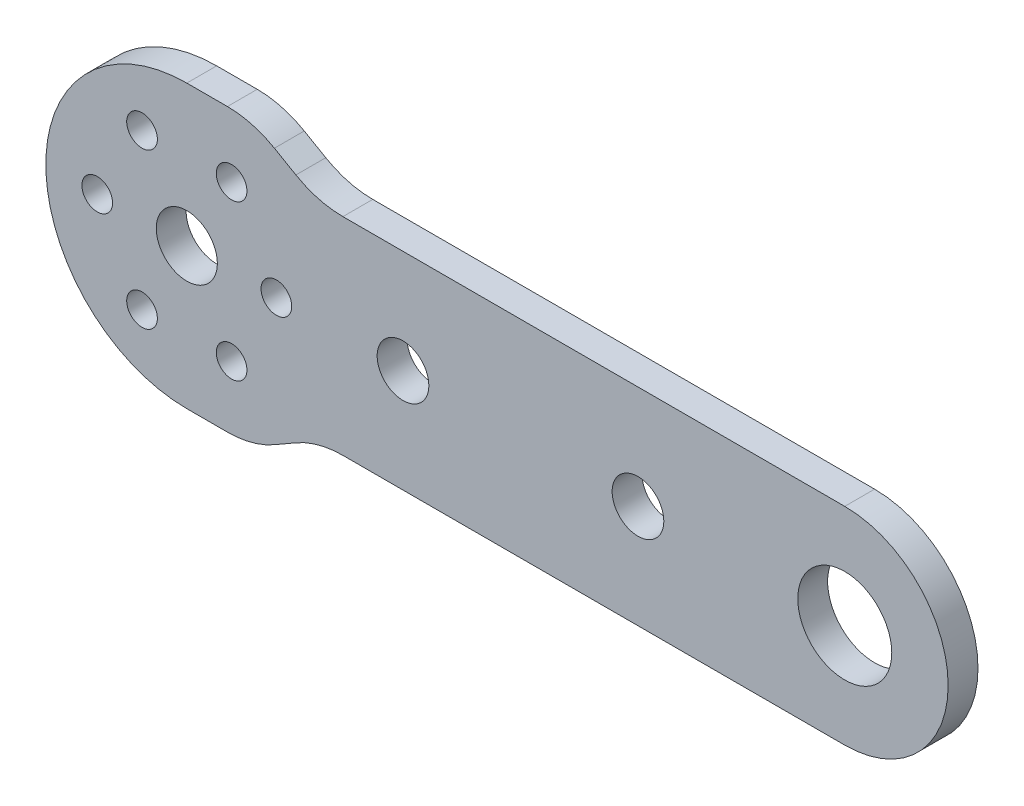
from build123d import *

# Parameters (mm, degrees)
CROQUIS1_R                       = 5
CROQUIS1_R_2                     = 3.25
SALIENTE_EXTRUIR1_DEPTH          = 3.175
TALADRO_DE_MARGEN_PARA_41_D      = 3.2639
TALADRO_DE_MARGEN_PARA_41_DEPTH  = 10
TALADRO_DE_MARGEN_PARA_41_TIP    = 0.980574487
TALADRO_DE_MARGEN_PARA_M51_D     = 5.5
TALADRO_DE_MARGEN_PARA_M51_DEPTH = 6
TALADRO_DE_MARGEN_PARA_M51_TIP   = 1.652366702
REDONDEO1_R                      = 10


with BuildPart() as part:
    # Croquis1 → Saliente-Extruir1 (new body)
    with BuildSketch(Plane.XY.offset(86.203907482)):
        with BuildLine():
            Line((0, -15), (7, -15))
            Line((7, -15), (13.92820323, -11))
            Line((13.92820323, -11), (70, -11))
            ThreePointArc((70, -11), (81, 0), (70, 11))
            Line((70, 11), (13.92820323, 11))
            Line((13.92820323, 11), (7, 15))
            Line((7, 15), (0, 15))
            ThreePointArc((0, 15), (-15, 0), (0, -15))
        make_face()
        with Locations((70, 0)):
            Circle(CROQUIS1_R, mode=Mode.SUBTRACT)
        Circle(CROQUIS1_R_2, mode=Mode.SUBTRACT)
    extrude(amount=SALIENTE_EXTRUIR1_DEPTH)

    # Taladro de margen para #41
    with Locations(Plane.XY.offset(89.378907482)):
        with Locations((9.53, 0), (4.765, -8.253222098), (-4.765, -8.253222098), (-9.53, 0), (-4.765, 8.253222098), (4.765, 8.253222098)):
            Hole(TALADRO_DE_MARGEN_PARA_41_D / 2, depth=TALADRO_DE_MARGEN_PARA_41_DEPTH)
            with Locations((0, 0, -(TALADRO_DE_MARGEN_PARA_41_DEPTH + TALADRO_DE_MARGEN_PARA_41_TIP / 2))):  # 118° drill point
                Cone(0, TALADRO_DE_MARGEN_PARA_41_D / 2, TALADRO_DE_MARGEN_PARA_41_TIP, mode=Mode.SUBTRACT)

    # Taladro de margen para M51
    with Locations(Plane.XY.offset(89.378907482)):
        with Locations((23, 0), (48, 0)):
            Hole(TALADRO_DE_MARGEN_PARA_M51_D / 2, depth=TALADRO_DE_MARGEN_PARA_M51_DEPTH)
            with Locations((0, 0, -(TALADRO_DE_MARGEN_PARA_M51_DEPTH + TALADRO_DE_MARGEN_PARA_M51_TIP / 2))):  # 118° drill point
                Cone(0, TALADRO_DE_MARGEN_PARA_M51_D / 2, TALADRO_DE_MARGEN_PARA_M51_TIP, mode=Mode.SUBTRACT)

    # Redondeo1
    redondeo1_edges = [part.edges().sort_by_distance(p)[0] for p in [
        (7, 15, 87.791407482),
        (13.92820323, 11, 87.791407482),
        (13.92820323, -11, 87.791407482),
        (7, -15, 87.791407482),
    ]]
    fillet(redondeo1_edges, radius=REDONDEO1_R)


solid = part.part
